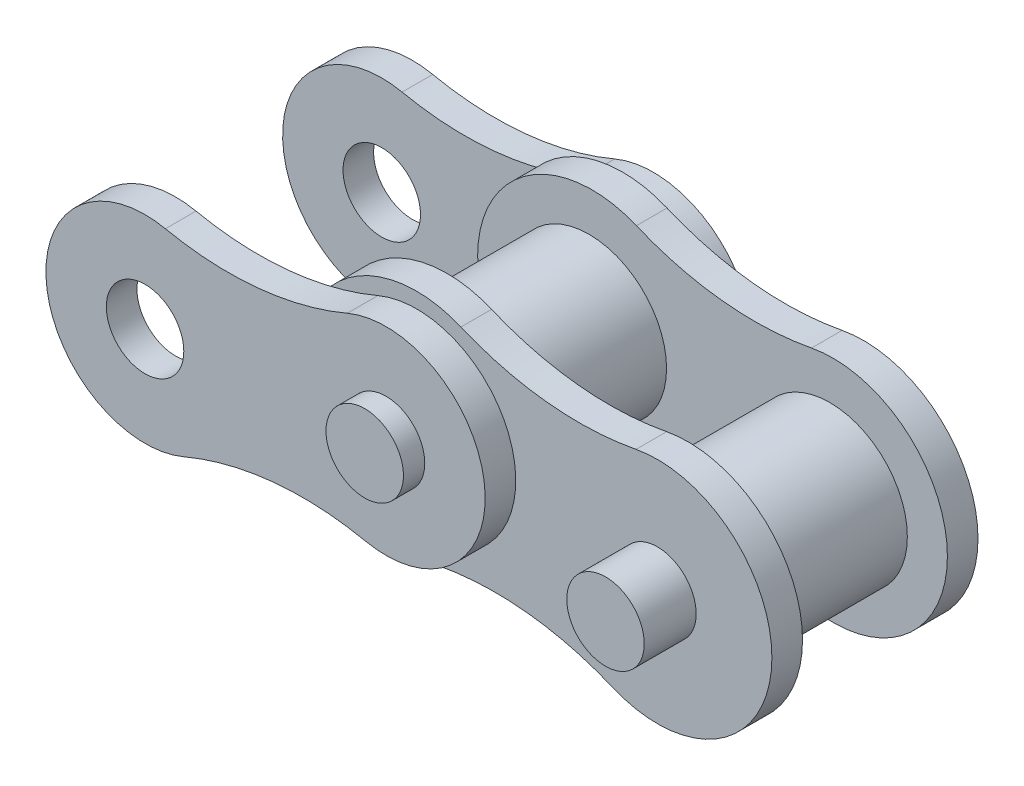
from build123d import *

# Parameters (mm, degrees)
BOSS_EXTRUDE1_START        = 4.75
SKETCH1_R                  = 2.54
BOSS_EXTRUDE1_DEPTH        = 2.0066
SKETCH2_R                  = 2.54
BOSS_EXTRUDE2_DEPTH        = 2.0066
BOSS_EXTRUDE3_DEPTH        = 10.16
BOSS_EXTRUDE3_DEPTH_BACK   = 10.16
SKETCH3_R                  = 2.54
BOSS_EXTRUDE3_2_DEPTH      = 10.16
BOSS_EXTRUDE3_2_DEPTH_BACK = 10.16
BOSS_EXTRUDE4_DEPTH        = 4.55
BOSS_EXTRUDE4_DEPTH_BACK   = 4.55
SKETCH4_R                  = 5.08
BOSS_EXTRUDE4_2_DEPTH      = 4.55
BOSS_EXTRUDE4_2_DEPTH_BACK = 4.55


with BuildPart() as part:
    # Sketch1 → Boss-Extrude1 (new body)
    with BuildSketch(Plane.XY.offset(BOSS_EXTRUDE1_START)):
        with BuildLine():
            ThreePointArc((2.905282898, 82.857111517), (-7.464583257, 76.721056751), (1.402924463, 68.563079122))
            ThreePointArc((1.402924463, 68.563079122), (7.231777772, 68.805994183), (12.882752755, 67.356504491))
            ThreePointArc((12.882752755, 67.356504491), (23.252618909, 73.492559257), (14.38511119, 81.650536886))
            ThreePointArc((14.38511119, 81.650536886), (8.556257881, 81.407621825), (2.905282898, 82.857111517))
        make_face()
        with Locations((0, 75.9365)):
            Circle(SKETCH1_R, mode=Mode.SUBTRACT)
        with Locations((15.788035653, 74.277116008)):
            Circle(SKETCH1_R, mode=Mode.SUBTRACT)
    extrude(amount=BOSS_EXTRUDE1_DEPTH)


with BuildPart() as body_2:
    # Sketch2 → Boss-Extrude2 (new body)
    with BuildSketch(Plane.XY.offset(6.7566)):
        with BuildLine():
            ThreePointArc((-1.334815218, 69.575032533), (6.46921099, 76.568409147), (-2.540608347, 81.91941812))
            ThreePointArc((-2.540608347, 81.91941812), (-8.413528963, 80.423132366), (-14.464988546, 80.754650897))
            ThreePointArc((-14.464988546, 80.754650897), (-22.269014753, 73.761274284), (-13.259195417, 68.41026531))
            ThreePointArc((-13.259195417, 68.41026531), (-7.386274801, 69.906551064), (-1.334815218, 69.575032533))
        make_face()
        with Locations((0, 75.9365)):
            Circle(SKETCH2_R, mode=Mode.SUBTRACT)
        with Locations((-15.799803764, 74.39318343)):
            Circle(SKETCH2_R, mode=Mode.SUBTRACT)
    extrude(amount=BOSS_EXTRUDE2_DEPTH)


with BuildPart() as body_3:
    # Mirror1: mirrored copy
    add(body_2.part.mirror(Plane.XY))


with BuildPart() as body_4:
    # Mirror1 2: mirrored copy
    add(part.part.mirror(Plane.XY))


with BuildPart() as body_5:
    # Sketch3 → Boss-Extrude3 (new, two sides: drawn at the far end of the back side and taken through both)
    with BuildSketch(Plane(origin=(0, 0, 0), x_dir=(-1, 0, 0), z_dir=(0, 0, -1)).offset(-BOSS_EXTRUDE3_DEPTH_BACK)):
        with Locations((0, 75.9365)):
            Circle(SKETCH3_R)
    extrude(amount=BOSS_EXTRUDE3_DEPTH + BOSS_EXTRUDE3_DEPTH_BACK)


with BuildPart() as body_6:
    # Sketch3 → Boss-Extrude3 2 (new, two sides: drawn at the far end of the back side and taken through both)
    with BuildSketch(Plane(origin=(0, 0, 0), x_dir=(-1, 0, 0), z_dir=(0, 0, -1)).offset(-BOSS_EXTRUDE3_2_DEPTH_BACK)):
        with Locations((-15.788035653, 74.277116008)):
            Circle(SKETCH3_R)
    extrude(amount=BOSS_EXTRUDE3_2_DEPTH + BOSS_EXTRUDE3_2_DEPTH_BACK)


with BuildPart() as body_7:
    # Sketch4 → Boss-Extrude4 (new, two sides: drawn at the far end of the back side and taken through both)
    with BuildSketch(Plane.XY.offset(-BOSS_EXTRUDE4_DEPTH_BACK)):
        with Locations(Location((0, 75.9365, 0), (0, 0, 180))):
            Circle(SKETCH4_R)
    extrude(amount=BOSS_EXTRUDE4_DEPTH + BOSS_EXTRUDE4_DEPTH_BACK)


with BuildPart() as body_8:
    # Sketch4 → Boss-Extrude4 2 (new, two sides: drawn at the far end of the back side and taken through both)
    with BuildSketch(Plane.XY.offset(-BOSS_EXTRUDE4_2_DEPTH_BACK)):
        with Locations(Location((15.788035653, 74.277116008, 0), (0, 0, 180))):
            Circle(SKETCH4_R)
    extrude(amount=BOSS_EXTRUDE4_2_DEPTH + BOSS_EXTRUDE4_2_DEPTH_BACK)


solid = Compound([part.part, body_2.part, body_3.part, body_4.part, body_5.part, body_6.part, body_7.part, body_8.part])
